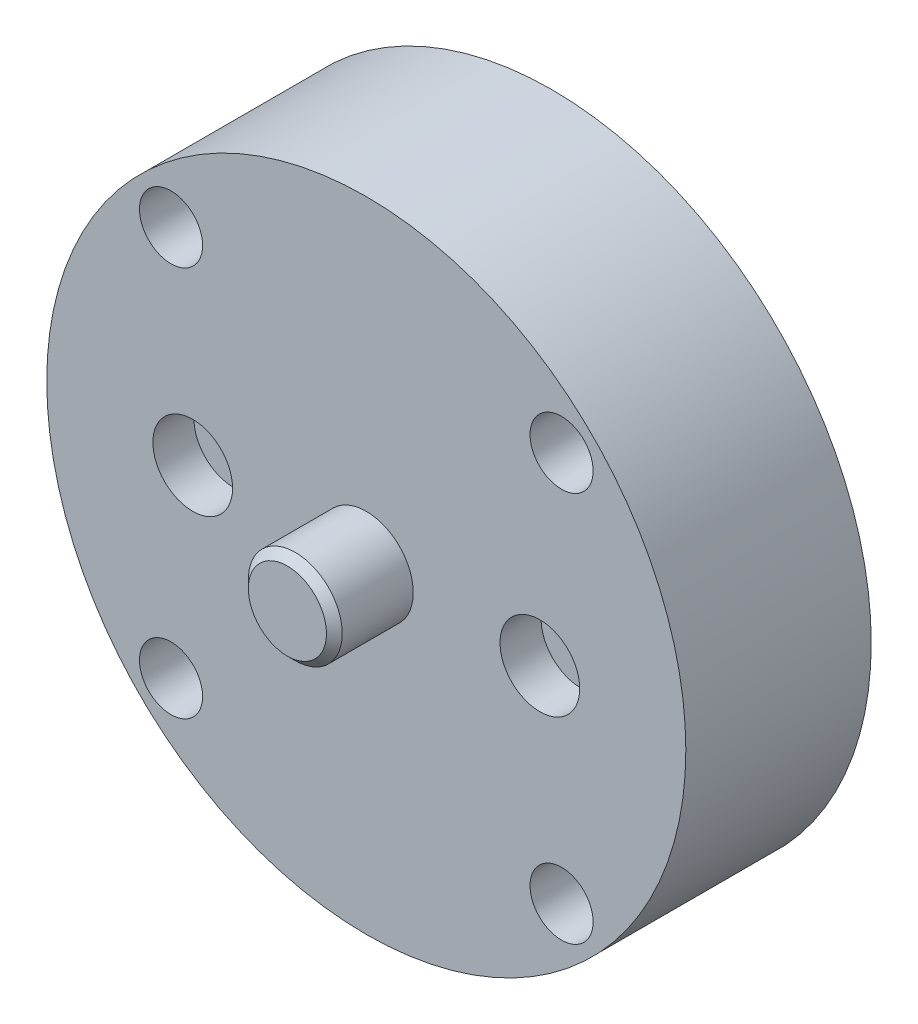
from build123d import *

# Parameters (mm, degrees)
SKETCH1_W                                        = 40.5
SKETCH1_H                                        = 23.5
SKETCH2_R                                        = 5.95
BOSS_EXTRUDE1_DEPTH                              = 10
HOLE1_D                                          = 10.1
HOLE1_DEPTH                                      = 5.2
CBORE_FOR_M4_HEX_HEAD_MACHINE_SCREW1_D           = 4.5
CBORE_FOR_M4_HEX_HEAD_MACHINE_SCREW1_CBORE_D     = 8
CBORE_FOR_M4_HEX_HEAD_MACHINE_SCREW1_CBORE_DEPTH = 6
CHAMFER1_SIZE                                    = 1


with BuildPart() as part:
    # Sketch1 → Revolve1 (revolve)
    with BuildSketch(Plane.XZ, mode=Mode.PRIVATE) as revolve1_sk:
        with Locations((20.25, 11.75)):
            Rectangle(SKETCH1_W, SKETCH1_H)
    revolve(revolve1_sk.sketch.rotate(Axis((0, 0, 23.5), (0, 0, -1)), 180), axis=Axis((0, 0, 23.5), (0, 0, -1)))

    # Sketch2 → Boss-Extrude1 (add)
    with BuildSketch(Plane.XY.offset(23.5)):
        Circle(SKETCH2_R)
    extrude(amount=BOSS_EXTRUDE1_DEPTH)

    # Hole1
    with Locations(Plane.XY.offset(23.5)):
        with Locations((22, 0), (-22, 0)):
            Hole(HOLE1_D / 2, depth=HOLE1_DEPTH)

    # CBORE for M4 Hex Head Machine Screw1 (through all)
    with Locations(Plane.XY.offset(23.5)):
        with Locations((24.748737342, 24.748737342), (-24.748737342, 24.748737342), (24.748737342, -24.748737342), (-24.748737342, -24.748737342)):
            CounterBoreHole(CBORE_FOR_M4_HEX_HEAD_MACHINE_SCREW1_D / 2, CBORE_FOR_M4_HEX_HEAD_MACHINE_SCREW1_CBORE_D / 2, CBORE_FOR_M4_HEX_HEAD_MACHINE_SCREW1_CBORE_DEPTH)

    # Chamfer1
    chamfer1_edges = [part.edges().sort_by_distance(p)[0] for p in [
        (-5.95, 0, 33.5),
    ]]
    chamfer(chamfer1_edges, length=CHAMFER1_SIZE)


solid = part.part
